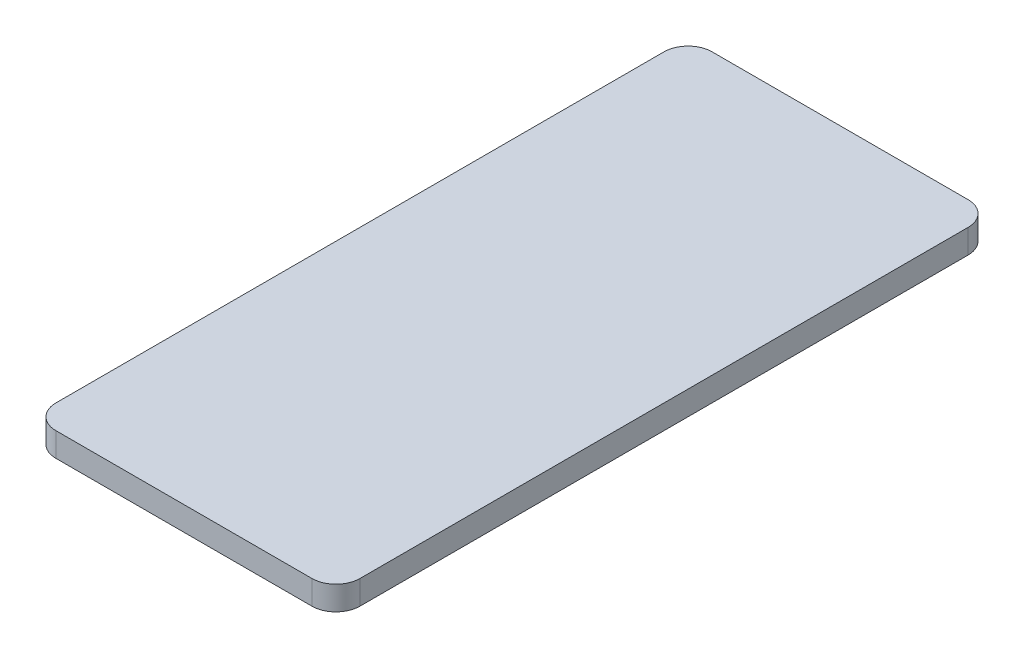
from build123d import *

# Parameters (mm, degrees)
BOSS_EXTRUDE1_DEPTH = 3


with BuildPart() as part:
    # Sketch1 → Boss-Extrude1 (new body)
    with BuildSketch(Plane(origin=(0, 0, 0), x_dir=(1, 0, 0), z_dir=(0, 1, 0))):
        with BuildLine():
            Line((-16, -41), (16, -41))
            ThreePointArc((16, -41), (18.121320344, -40.121320344), (19, -38))
            Line((19, -38), (19, 38))
            ThreePointArc((19, 38), (18.121320344, 40.121320344), (16, 41))
            Line((16, 41), (-16, 41))
            ThreePointArc((-16, 41), (-18.121320344, 40.121320344), (-19, 38))
            Line((-19, 38), (-19, -38))
            ThreePointArc((-19, -38), (-18.121320344, -40.121320344), (-16, -41))
        make_face()
    extrude(amount=BOSS_EXTRUDE1_DEPTH)


solid = part.part
